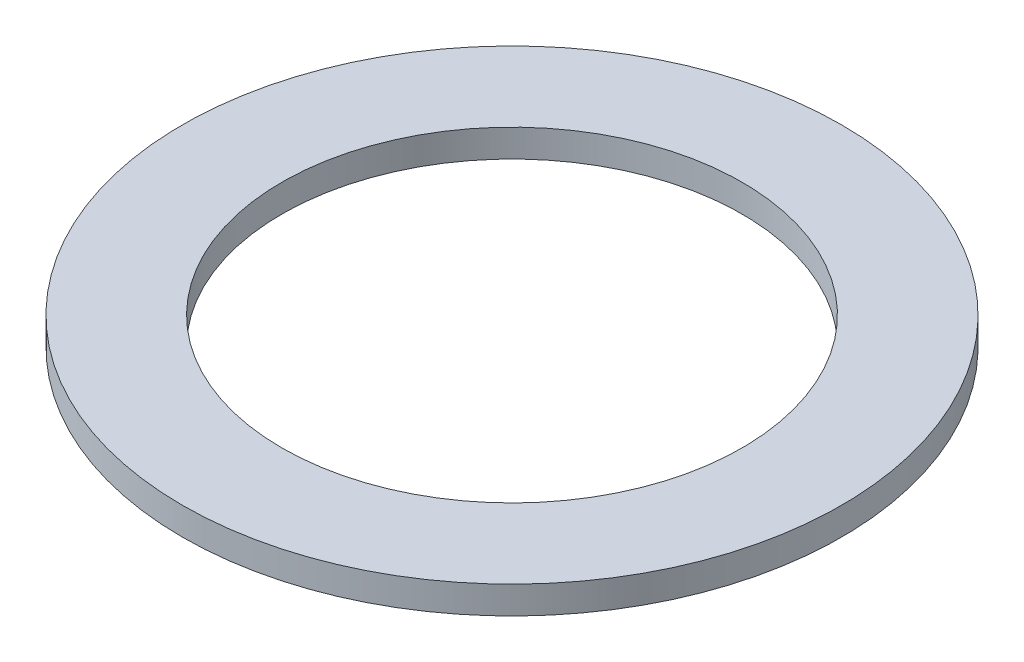
from build123d import *

# Parameters (mm, degrees)
SKETCH_1_R          = 35.8
SKETCH_1_R_2        = 2
SKETCH_1_R_3        = 7.5
EXTRUDE_1_DEPTH     = 3
SKETCH_2_R          = 25
CUT_EXTRUDE_1_DEPTH = 10


with BuildPart() as part:
    # 草图1 → 凸台-拉伸1 (new body)
    with BuildSketch(Plane(origin=(0, 0, 0), x_dir=(1, 0, 0), z_dir=(0, 1, 0))):
        with Locations(Location((0, 0, 0), (0, 0, 270))):
            Circle(SKETCH_1_R)
        with Locations(Location((0, -20, 0), (0, 0, 270))):
            Circle(SKETCH_1_R_2, mode=Mode.SUBTRACT)
        with Locations(Location((-17.320508076, 10, 0), (0, 0, 270))):
            Circle(SKETCH_1_R_2, mode=Mode.SUBTRACT)
        with Locations(Location((17.320508076, 10, 0), (0, 0, 270))):
            Circle(SKETCH_1_R_2, mode=Mode.SUBTRACT)
        with Locations(Location((0, 0, 0), (0, 0, 270))):
            Circle(SKETCH_1_R_3, mode=Mode.SUBTRACT)
    extrude(amount=EXTRUDE_1_DEPTH)

    # 草图2 → 切除-拉伸1 (cut)
    with BuildSketch(Plane(origin=(0, 3, 0), x_dir=(1, 0, 0), z_dir=(0, 1, 0))):
        with Locations(Location((0, 0, 0), (0, 0, 270))):
            Circle(SKETCH_2_R)
    extrude(amount=-CUT_EXTRUDE_1_DEPTH, mode=Mode.SUBTRACT)


solid = part.part
